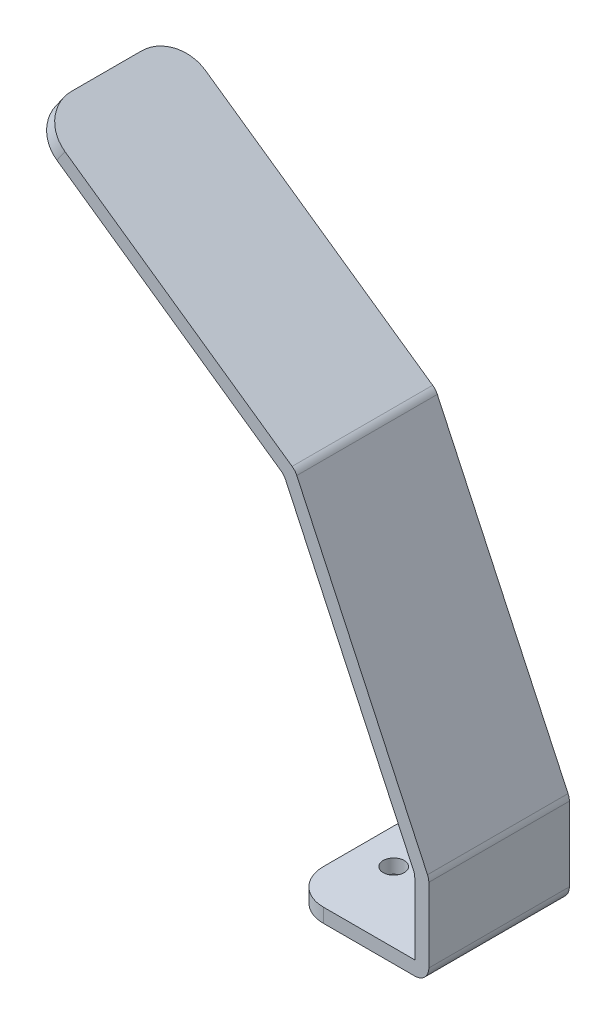
from build123d import *

# Parameters (mm, degrees)
BOSS_EXTRUDE1_DEPTH = 10
FILLET1_R           = 2
FILLET2_R           = 5
SKETCH2_R           = 1.5
CUT_EXTRUDE1_DEPTH  = 3


with BuildPart() as part:
    # Sketch1 → Boss-Extrude1 (new, symmetric)
    with BuildSketch(Plane.XY):
        Polygon((0, 0), (20, 0), (20, 13), (0.982178222, 53.783850417), (-35.879663771, 79.594790052), (-37.026816644, 77.956485964), (-0.603956909, 52.452925014), (18, 12.556610675), (18, 2), (0, 2), align=None)
    extrude(amount=BOSS_EXTRUDE1_DEPTH, both=True)

    # Fillet1
    fillet1_edges = [part.edges().sort_by_distance(p)[0] for p in [
        (18, 12.556610675, 0),
        (-0.603956909, 52.452925014, 0),
        (0.982178222, 53.783850417, 0),
        (20, 13, 0),
        (20, 0, 0),
    ]]
    fillet(fillet1_edges, radius=FILLET1_R)

    # Fillet2
    fillet2_edges = [part.edges().sort_by_distance(p)[0] for p in [
        (-36.453240208, 78.775638008, -10),
        (0, 1, -10),
        (-36.453240208, 78.775638008, 10),
        (0, 1, 10),
    ]]
    fillet(fillet2_edges, radius=FILLET2_R)

    # Sketch2 → Cut-Extrude1 (cut)
    with BuildSketch(Plane.XZ):
        with Locations(Location((5, 0, 0), (0, 0, 270))):
            Circle(SKETCH2_R)
        with Locations(Location((15, 0, 0), (0, 0, 270))):
            Circle(SKETCH2_R)
    extrude(amount=-CUT_EXTRUDE1_DEPTH, mode=Mode.SUBTRACT)


solid = part.part
